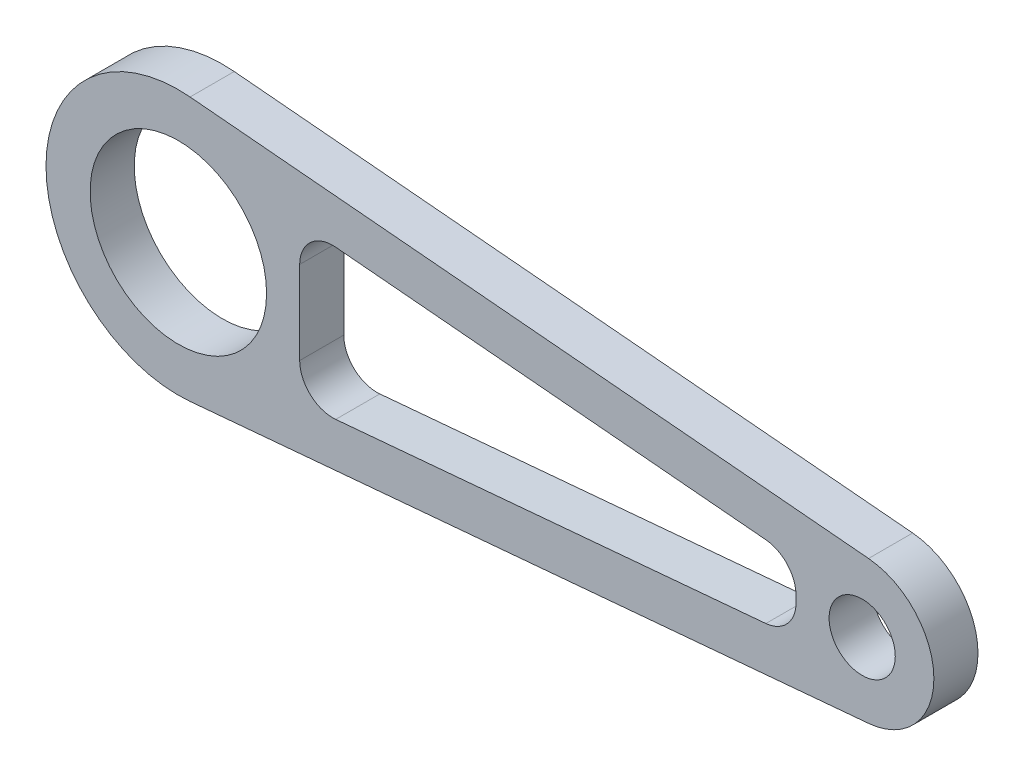
from build123d import *

# Parameters (mm, degrees)
ESQUISSE1_R          = 8
ESQUISSE1_R_2        = 3
BASE_EXTRUSION_DEPTH = 2


with BuildPart() as part:
    # Esquisse1 → Base-Extrusion (new, symmetric)
    with BuildSketch(Plane.XY):
        with BuildLine():
            Line((1.064516129, 11.9526903), (62.576612903, 6.474373913))
            ThreePointArc((62.576612903, 6.474373913), (68.5, 0), (62.576612903, -6.474373913))
            Line((62.576612903, -6.474373913), (1.064516129, -11.9526903))
            ThreePointArc((1.064516129, -11.9526903), (-12, 0), (1.064516129, 11.9526903))
        make_face()
        Circle(ESQUISSE1_R, mode=Mode.SUBTRACT)
        with Locations((62, 0)):
            Circle(ESQUISSE1_R_2, mode=Mode.SUBTRACT)
        with BuildLine():
            Line((14.266129032, 6.76111181), (53.266129032, 3.287740712))
            ThreePointArc((53.266129032, 3.287740712), (55.213412196, 2.324612939), (56, 0.299568137))
            Line((56, 0.299568137), (56, -0.299568137))
            ThreePointArc((56, -0.299568137), (55.213412196, -2.324612939), (53.266129032, -3.287740712))
            Line((53.266129032, -3.287740712), (14.266129032, -6.76111181))
            ThreePointArc((14.266129032, -6.76111181), (11.974955198, -5.98635143), (11, -3.772939235))
            Line((11, -3.772939235), (11, 3.772939235))
            ThreePointArc((11, 3.772939235), (11.974955198, 5.98635143), (14.266129032, 6.76111181))
        make_face(mode=Mode.SUBTRACT)
    extrude(amount=BASE_EXTRUSION_DEPTH, both=True)


solid = part.part
